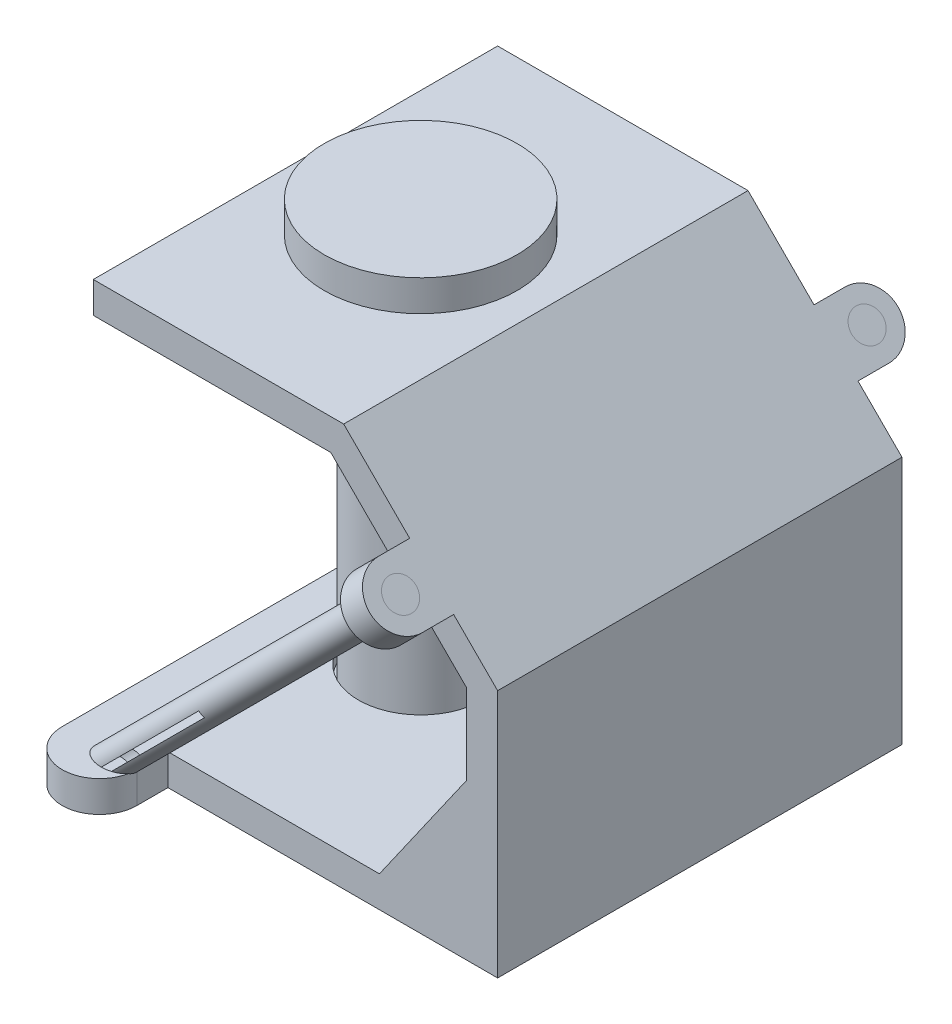
from build123d import *

# Parameters (mm, degrees)
BOSS_EXTRUDE1_DEPTH              = 32.5
RIB1_REACH                       = 114.438
SKETCH2_WALL_W                   = 251.292337958
SKETCH2_WALL_H                   = 5
BOSS_EXTRUDE2_DEPTH              = 5
BOSS_EXTRUDE3_DEPTH              = 5
CUT_EXTRUDE1_REACH               = 91.051
CUT_EXTRUDE1_OFFSET_FROM_SURFACE = 3
SKETCH5_R                        = 2.5
BOSS_EXTRUDE4_REACH              = 88.051
SKETCH6_R                        = 2.5
SKETCH7_R                        = 10
CUT_EXTRUDE2_DEPTH               = 61.748737342
SKETCH8_R                        = 9.5
BOSS_EXTRUDE5_DEPTH              = 61.748737342
SKETCH9_R                        = 15.5
BOSS_EXTRUDE6_DEPTH              = 5
CUT_EXTRUDE_THIN1_DEPTH          = 127.736484003
CUT_EXTRUDE_THIN1_DEPTH_BACK     = 127.736484003


with BuildPart() as part:
    # Sketch1 → Boss-Extrude1 (new, symmetric)
    with BuildSketch(Plane.XY):
        Polygon((0, 0), (65, 0), (65, 40), (40.251262658, 64.748737342), (0, 64.748737342), (0, 59.748737342), (38.180194847, 59.748737342), (60, 37.928932188), (60, 5), (0, 5), align=None)
    extrude(amount=BOSS_EXTRUDE1_DEPTH, both=True)

    # Sketch2 wall → Rib1 (add, up to next)
    with BuildSketch(Plane(origin=(52.997924618, 15, 32.5), x_dir=(-0.573576436346, -0.819152044293, 0), z_dir=(0.819152044293, -0.573576436346, 0)), mode=Mode.PRIVATE) as rib1_sk1:
        with Locations((0, 2.5)):
            Rectangle(SKETCH2_WALL_W, SKETCH2_WALL_H)
    rib1_tool1 = extrude(rib1_sk1.sketch, amount=RIB1_REACH, mode=Mode.PRIVATE) - part.part
    rib1 = rib1_tool1.solids().sort_by_distance((52.997924618, 15, 32.5))[0]
    add(rib1)

    # Mirror1: Rib1 across plane
    add(rib1.mirror(Plane.XY))

    # Sketch3 → Boss-Extrude2 (add)
    with BuildSketch(Plane(origin=(52.5, 52.5, 0), x_dir=(0, 0, -1), z_dir=(0.707106781186546, 0.707106781186549, 0))):
        with BuildLine():
            Line((-32.5, -7.67766953), (-37.5, -7.67766953))
            ThreePointArc((-37.5, -7.67766953), (-42.5, -2.67766953), (-37.5, 2.32233047))
            Line((-37.5, 2.32233047), (-32.5, 2.32233047))
            Line((-32.5, 2.32233047), (-32.5, -7.67766953))
        make_face()
    boss_extrude2 = extrude(amount=-BOSS_EXTRUDE2_DEPTH)

    # Mirror2: Boss-Extrude2 across plane
    add(boss_extrude2.mirror(Plane.XY))

    # Sketch4 → Boss-Extrude3 (add)
    with BuildSketch(Plane(origin=(0, 5, 0), x_dir=(1, 0, 0), z_dir=(0, 1, 0))):
        with BuildLine():
            Line((0, -32.5), (0, -37.5))
            ThreePointArc((0, -37.5), (6, -43.5), (12, -37.5))
            Line((12, -37.5), (12, -32.5))
            Line((12, -32.5), (0, -32.5))
        make_face()
    boss_extrude3 = extrude(amount=-BOSS_EXTRUDE3_DEPTH)

    # Mirror3: Boss-Extrude3 across plane
    add(boss_extrude3.mirror(Plane.XY))

    # Cut-Extrude1: up to this face of the body (flat: up to its plane, moved by the offset)
    cut_extrude1_end = Plane(part.part.faces().sort_by_distance((31.114413521, 0, 0))[0]).offset(-CUT_EXTRUDE1_OFFSET_FROM_SURFACE)
    # Sketch5 → Cut-Extrude1 (cut, up to the picked face)
    with BuildSketch(Plane(origin=(52.5, 52.5, 0), x_dir=(0, 0, -1), z_dir=(0.707106781186546, 0.707106781186549, 0)), mode=Mode.PRIVATE) as cut_extrude1_sk1:
        with Locations(Location((-37.5, -2.67766953, 0), (0, 0, 270))):
            Circle(SKETCH5_R)
    cut_extrude1_tool1 = split(extrude(cut_extrude1_sk1.sketch, amount=-CUT_EXTRUDE1_REACH, mode=Mode.PRIVATE), bisect_by=cut_extrude1_end, keep=Keep.BOTH, mode=Mode.PRIVATE)
    cut_extrude1 = cut_extrude1_tool1.solids().sort_by(Axis((54.393398, 50.606602, 37.5), (-0.707106781186546, -0.707106781186549, 0)))[0]
    add(cut_extrude1, mode=Mode.SUBTRACT)

    # Mirror4: Cut-Extrude1 across plane
    add(cut_extrude1.mirror(Plane.XY), mode=Mode.SUBTRACT)

    # Sketch7 → Cut-Extrude2 (cut)
    with BuildSketch(Plane(origin=(0, 64.748737342, 0), x_dir=(1, 0, 0), z_dir=(0, 1, 0))):
        with Locations(Location((20.125631329, 0, 0), (0, 0, 270))):
            Circle(SKETCH7_R)
    extrude(amount=-CUT_EXTRUDE2_DEPTH, mode=Mode.SUBTRACT)


with BuildPart() as body_2:
    # Boss-Extrude4: up to this plane
    boss_extrude4_end = Plane(origin=(0, 3, -32.5), z_dir=(0, -1, 0))
    # Sketch6 → Boss-Extrude4 (new, up to the surface)
    with BuildSketch(Plane(origin=(52.5, 52.5, 0), x_dir=(0, 0, -1), z_dir=(0.707106781186546, 0.707106781186549, 0)), mode=Mode.PRIVATE) as boss_extrude4_sk1:
        with Locations(Location((-37.5, -2.67766953, 0), (0, 0, 270))):
            Circle(SKETCH6_R)
    boss_extrude4_tool1 = split(extrude(boss_extrude4_sk1.sketch, amount=-BOSS_EXTRUDE4_REACH, mode=Mode.PRIVATE), bisect_by=boss_extrude4_end, keep=Keep.BOTH, mode=Mode.PRIVATE)
    add(boss_extrude4_tool1.solids().sort_by_distance((54.393398, 50.606602, 37.5))[0])


with BuildPart() as body_3:
    # Mirror7: mirrored copy
    add(body_2.part.mirror(Plane.XY))


with BuildPart() as body_4:
    # Sketch8 → Boss-Extrude5 (new body)
    with BuildSketch(Plane(origin=(0, 64.748737342, 0), x_dir=(1, 0, 0), z_dir=(0, 1, 0))):
        with Locations(Location((20.125631329, 0, 0), (0, 0, 270))):
            Circle(SKETCH8_R)
    extrude(amount=-BOSS_EXTRUDE5_DEPTH)


with BuildPart() as body_5:
    # Sketch9 → Boss-Extrude6 (new body)
    with BuildSketch(Plane(origin=(0, 64.748737342, 0), x_dir=(1, 0, 0), z_dir=(0, 1, 0))):
        with Locations(Location((20.125631329, 0, 0), (0, 0, 270))):
            Circle(SKETCH9_R)
    extrude(amount=BOSS_EXTRUDE6_DEPTH)


with BuildPart() as body_4_1:
    add(body_4.part)

    # Combine1: union body 5
    add(body_5.part)


with BuildPart() as cut_extrude_thin1_tool:
    # Sketch12 → Cut-Extrude-Thin1 (new, two sides: drawn at the far end of the back side and taken through both)
    with BuildSketch(Plane(origin=(0, 0, -40), x_dir=(-1, 0, 0), z_dir=(0, 0, -1)).offset(-CUT_EXTRUDE_THIN1_DEPTH_BACK)):
        Polygon((-24.464466094, 20.67766953), (-6.786796564, 3), (-7.493903346, 2.292893219), (-25.171572875, 19.970562748), align=None)
    extrude(amount=CUT_EXTRUDE_THIN1_DEPTH + CUT_EXTRUDE_THIN1_DEPTH_BACK)


with BuildPart() as body_3_1:
    add(body_3.part)

    # Cut-Extrude-Thin1: cut by cut_extrude_thin1_tool
    add(cut_extrude_thin1_tool.part, mode=Mode.SUBTRACT)


with BuildPart() as body_2_1:
    add(body_2.part)

    # Cut-Extrude-Thin1: cut by cut_extrude_thin1_tool
    add(cut_extrude_thin1_tool.part, mode=Mode.SUBTRACT)


solid = Compound([part.part, body_4_1.part, body_3_1.part, body_2_1.part])
